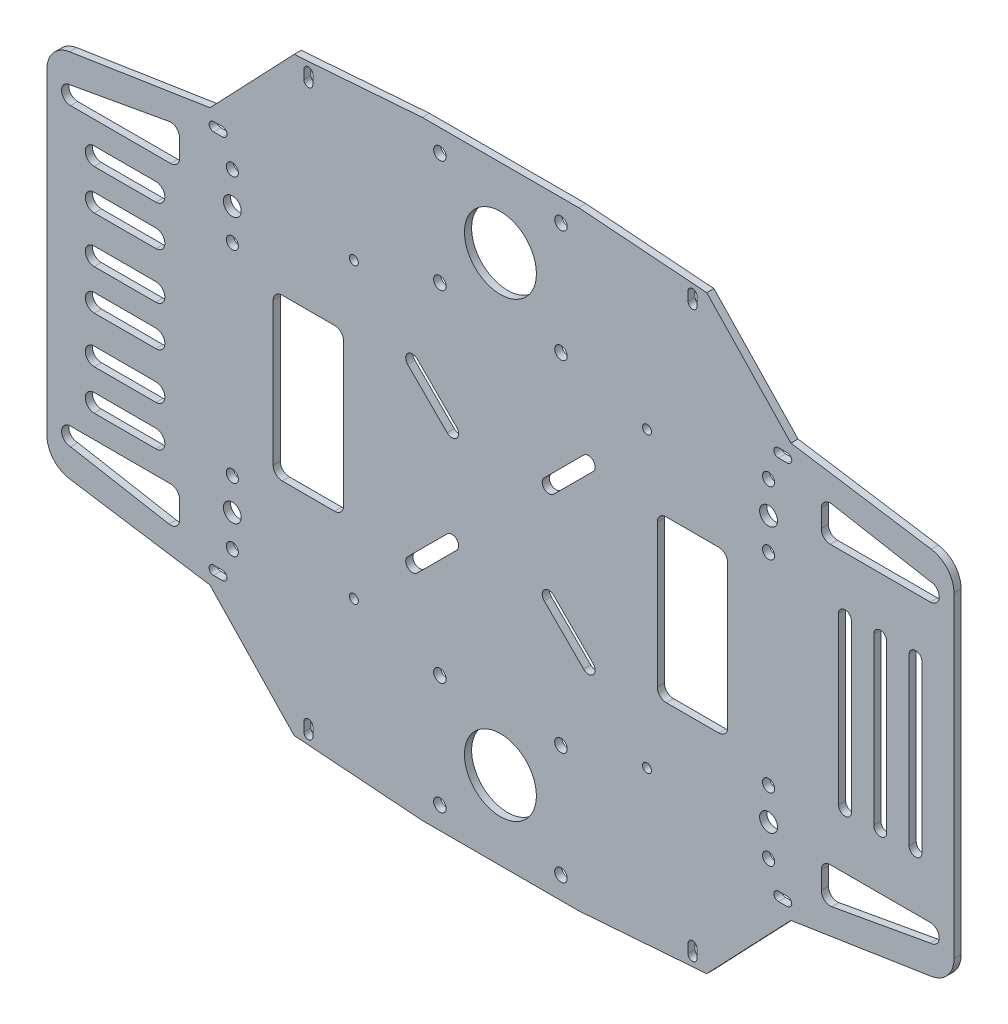
from build123d import *

# Parameters (mm, degrees)
BOSS_EXTRUDE1_DEPTH = 1.6
SKETCH2_R           = 8.05
SKETCH2_R_2         = 1.4
CUT_EXTRUDE1_DEPTH  = 1.6
CUT_EXTRUDE2_DEPTH  = 1.6
CUT_EXTRUDE3_DEPTH  = 1.6
CUT_EXTRUDE4_DEPTH  = 1.6
CUT_EXTRUDE5_DEPTH  = 1.6
SKETCH7_R           = 1
CUT_EXTRUDE6_DEPTH  = 1.6
SKETCH8_R           = 1.35
SKETCH8_R_2         = 2
CUT_EXTRUDE7_DEPTH  = 10


with BuildPart() as part:
    # Sketch1 → Boss-Extrude1 (new body)
    with BuildSketch(Plane.XY):
        with BuildLine():
            Line((0, 68.13), (-17.5, 68.13))
            Line((-17.5, 68.13), (-46.175, 66))
            Line((-46.175, 66), (-65, 46.25))
            Line((-65, 46.25), (-96.417835926, 41.386691151))
            ThreePointArc((-96.417835926, 41.386691151), (-100.055601802, 39.361984306), (-101.5, 35.457308619))
            Line((-101.5, 35.457308619), (-101.5, 0))
            Line((-101.5, 0), (-101.5, -35.457308619))
            ThreePointArc((-101.5, -35.457308619), (-100.055601802, -39.361984306), (-96.417835926, -41.386691151))
            Line((-96.417835926, -41.386691151), (-65, -46.25))
            Line((-65, -46.25), (-46.175, -66))
            Line((-46.175, -66), (-17.5, -68.13))
            Line((-17.5, -68.13), (0, -68.13))
            Line((0, -68.13), (17.5, -68.13))
            Line((17.5, -68.13), (46.175, -66))
            Line((46.175, -66), (65, -46.25))
            Line((65, -46.25), (96.417835926, -41.386691151))
            ThreePointArc((96.417835926, -41.386691151), (100.055601802, -39.361984306), (101.5, -35.457308619))
            Line((101.5, -35.457308619), (101.5, 0))
            Line((101.5, 0), (101.5, 35.457308619))
            ThreePointArc((101.5, 35.457308619), (100.055601802, 39.361984306), (96.417835926, 41.386691151))
            Line((96.417835926, 41.386691151), (65, 46.25))
            Line((65, 46.25), (46.175, 66))
            Line((46.175, 66), (17.5, 68.13))
            Line((17.5, 68.13), (0, 68.13))
        make_face()
    extrude(amount=BOSS_EXTRUDE1_DEPTH)

    # Sketch2 → Cut-Extrude1 (cut)
    with BuildSketch(Plane.XY.offset(1.6)):
        with Locations((0, -50.6)):
            Circle(SKETCH2_R)
        with Locations((0, 50.6)):
            Circle(SKETCH2_R)
        with Locations((-13.55, -38.05)):
            Circle(SKETCH2_R_2)
        with Locations((13.55, -38.05)):
            Circle(SKETCH2_R_2)
        with Locations((13.55, -63.15)):
            Circle(SKETCH2_R_2)
        with Locations((-13.55, -63.15)):
            Circle(SKETCH2_R_2)
        with Locations((-13.55, 38.05)):
            Circle(SKETCH2_R_2)
        with Locations((13.55, 38.05)):
            Circle(SKETCH2_R_2)
        with Locations((-13.55, 63.15)):
            Circle(SKETCH2_R_2)
        with Locations((13.55, 63.15)):
            Circle(SKETCH2_R_2)
    extrude(amount=-CUT_EXTRUDE1_DEPTH, mode=Mode.SUBTRACT)

    # Sketch3 → Cut-Extrude2 (cut)
    with BuildSketch(Plane.XY.offset(1.6)):
        with BuildLine():
            Line((-20.753584028, 18.632263684), (-11.914749263, 9.793428919))
            ThreePointArc((-11.914749263, 9.793428919), (-9.793428919, 9.793428919), (-9.793428919, 11.914749263))
            Line((-9.793428919, 11.914749263), (-18.632263684, 20.753584028))
            ThreePointArc((-18.632263684, 20.753584028), (-20.753584028, 20.753584028), (-20.753584028, 18.632263684))
        make_face()
        with BuildLine():
            Line((18.632263684, 20.753584028), (9.793428919, 11.914749263))
            ThreePointArc((9.793428919, 11.914749263), (9.793428919, 9.793428919), (11.914749263, 9.793428919))
            Line((11.914749263, 9.793428919), (20.753584028, 18.632263684))
            ThreePointArc((20.753584028, 18.632263684), (20.753584028, 20.753584028), (18.632263684, 20.753584028))
        make_face()
        with BuildLine():
            Line((20.753584028, -18.632263684), (11.914749263, -9.793428919))
            ThreePointArc((11.914749263, -9.793428919), (9.793428919, -9.793428919), (9.793428919, -11.914749263))
            Line((9.793428919, -11.914749263), (18.632263684, -20.753584028))
            ThreePointArc((18.632263684, -20.753584028), (20.753584028, -20.753584028), (20.753584028, -18.632263684))
        make_face()
        with BuildLine():
            Line((-18.632263684, -20.753584028), (-9.793428919, -11.914749263))
            ThreePointArc((-9.793428919, -11.914749263), (-9.793428919, -9.793428919), (-11.914749263, -9.793428919))
            Line((-11.914749263, -9.793428919), (-20.753584028, -18.632263684))
            ThreePointArc((-20.753584028, -18.632263684), (-20.753584028, -20.753584028), (-18.632263684, -20.753584028))
        make_face()
        with BuildLine():
            Line((35.1, 16), (35.1, -16))
            ThreePointArc((35.1, -16), (35.685786438, -17.414213562), (37.1, -18))
            Line((37.1, -18), (48.85, -18))
            ThreePointArc((48.85, -18), (50.264213562, -17.414213562), (50.85, -16))
            Line((50.85, -16), (50.85, 16))
            ThreePointArc((50.85, 16), (50.264213562, 17.414213562), (48.85, 18))
            Line((48.85, 18), (37.1, 18))
            ThreePointArc((37.1, 18), (35.685786438, 17.414213562), (35.1, 16))
        make_face()
        with BuildLine():
            Line((-37.1, -18), (-48.85, -18))
            ThreePointArc((-48.85, -18), (-50.264213562, -17.414213562), (-50.85, -16))
            Line((-50.85, -16), (-50.85, 16))
            ThreePointArc((-50.85, 16), (-50.264213562, 17.414213562), (-48.85, 18))
            Line((-48.85, 18), (-37.1, 18))
            ThreePointArc((-37.1, 18), (-35.685786438, 17.414213562), (-35.1, 16))
            Line((-35.1, 16), (-35.1, -16))
            ThreePointArc((-35.1, -16), (-35.685786438, -17.414213562), (-37.1, -18))
        make_face()
    extrude(amount=-CUT_EXTRUDE2_DEPTH, mode=Mode.SUBTRACT)

    # Sketch4 → Cut-Extrude3 (cut)
    with BuildSketch(Plane.XY.offset(1.6)):
        with BuildLine():
            Line((84, 31.05), (73.8, 31.05))
            ThreePointArc((73.8, 31.05), (72.385786438, 31.635786438), (71.8, 33.05))
            Line((71.8, 33.05), (71.8, 37.05))
            ThreePointArc((71.8, 37.05), (72.517158721, 38.584378784), (74.154318254, 39.018364442))
            Line((74.154318254, 39.018364442), (96.2, 35.05))
            ThreePointArc((96.2, 35.05), (98.2, 33.05), (96.2, 31.05))
            Line((96.2, 31.05), (84, 31.05))
        make_face()
        with BuildLine():
            Line((-84, 31.05), (-96.2, 31.05))
            ThreePointArc((-96.2, 31.05), (-98.2, 33.05), (-96.2, 35.05))
            Line((-96.2, 35.05), (-74.154318254, 39.018364442))
            ThreePointArc((-74.154318254, 39.018364442), (-72.517158721, 38.584378784), (-71.8, 37.05))
            Line((-71.8, 37.05), (-71.8, 33.05))
            ThreePointArc((-71.8, 33.05), (-72.385786438, 31.635786438), (-73.8, 31.05))
            Line((-73.8, 31.05), (-84, 31.05))
        make_face()
        with BuildLine():
            Line((84, -31.05), (96.2, -31.05))
            ThreePointArc((96.2, -31.05), (98.2, -33.05), (96.2, -35.05))
            Line((96.2, -35.05), (74.154318254, -39.018364442))
            ThreePointArc((74.154318254, -39.018364442), (72.517158721, -38.584378784), (71.8, -37.05))
            Line((71.8, -37.05), (71.8, -33.05))
            ThreePointArc((71.8, -33.05), (72.385786438, -31.635786438), (73.8, -31.05))
            Line((73.8, -31.05), (84, -31.05))
        make_face()
        with BuildLine():
            Line((-84, -31.05), (-73.8, -31.05))
            ThreePointArc((-73.8, -31.05), (-72.385786438, -31.635786438), (-71.8, -33.05))
            Line((-71.8, -33.05), (-71.8, -37.05))
            ThreePointArc((-71.8, -37.05), (-72.517158721, -38.584378784), (-74.154318254, -39.018364442))
            Line((-74.154318254, -39.018364442), (-96.2, -35.05))
            ThreePointArc((-96.2, -35.05), (-98.2, -33.05), (-96.2, -31.05))
            Line((-96.2, -31.05), (-84, -31.05))
        make_face()
    extrude(amount=-CUT_EXTRUDE3_DEPTH, mode=Mode.SUBTRACT)

    # Sketch5 → Cut-Extrude4 (cut)
    with BuildSketch(Plane.XY.offset(1.6)):
        with BuildLine():
            Line((-90.9, 16.9), (-77.1, 16.9))
            ThreePointArc((-77.1, 16.9), (-75.1, 14.9), (-77.1, 12.9))
            Line((-77.1, 12.9), (-90.9, 12.9))
            ThreePointArc((-90.9, 12.9), (-92.9, 14.9), (-90.9, 16.9))
        make_face()
        with BuildLine():
            Line((-90.9, 6.5), (-77.1, 6.5))
            ThreePointArc((-77.1, 6.5), (-75.1, 4.5), (-77.1, 2.5))
            Line((-77.1, 2.5), (-90.9, 2.5))
            ThreePointArc((-90.9, 2.5), (-92.9, 4.5), (-90.9, 6.5))
        make_face()
        with BuildLine():
            Line((-90.9, 25.9), (-77.1, 25.9))
            ThreePointArc((-77.1, 25.9), (-75.1, 23.9), (-77.1, 21.9))
            Line((-77.1, 21.9), (-90.9, 21.9))
            ThreePointArc((-90.9, 21.9), (-92.9, 23.9), (-90.9, 25.9))
        make_face()
        with BuildLine():
            Line((-90.9, -2.5), (-77.1, -2.5))
            ThreePointArc((-77.1, -2.5), (-75.1, -4.5), (-77.1, -6.5))
            Line((-77.1, -6.5), (-90.9, -6.5))
            ThreePointArc((-90.9, -6.5), (-92.9, -4.5), (-90.9, -2.5))
        make_face()
        with BuildLine():
            Line((-90.9, -12.9), (-77.1, -12.9))
            ThreePointArc((-77.1, -12.9), (-75.1, -14.9), (-77.1, -16.9))
            Line((-77.1, -16.9), (-90.9, -16.9))
            ThreePointArc((-90.9, -16.9), (-92.9, -14.9), (-90.9, -12.9))
        make_face()
        with BuildLine():
            Line((-90.9, -21.9), (-77.1, -21.9))
            ThreePointArc((-77.1, -21.9), (-75.1, -23.9), (-77.1, -25.9))
            Line((-77.1, -25.9), (-90.9, -25.9))
            ThreePointArc((-90.9, -25.9), (-92.9, -23.9), (-90.9, -21.9))
        make_face()
    extrude(amount=-CUT_EXTRUDE4_DEPTH, mode=Mode.SUBTRACT)

    # Sketch6 → Cut-Extrude5 (cut)
    with BuildSketch(Plane.XY.offset(1.6)):
        with BuildLine():
            Line((86.45, -18.55), (86.45, 18.55))
            ThreePointArc((86.45, 18.55), (85, 20), (83.55, 18.55))
            Line((83.55, 18.55), (83.55, -18.55))
            ThreePointArc((83.55, -18.55), (85, -20), (86.45, -18.55))
        make_face()
        with BuildLine():
            Line((78.55, -18.55), (78.55, 18.55))
            ThreePointArc((78.55, 18.55), (77.1, 20), (75.65, 18.55))
            Line((75.65, 18.55), (75.65, -18.55))
            ThreePointArc((75.65, -18.55), (77.1, -20), (78.55, -18.55))
        make_face()
        with BuildLine():
            Line((94.35, -18.55), (94.35, 18.55))
            ThreePointArc((94.35, 18.55), (92.9, 20), (91.45, 18.55))
            Line((91.45, 18.55), (91.45, -18.55))
            ThreePointArc((91.45, -18.55), (92.9, -20), (94.35, -18.55))
        make_face()
    extrude(amount=-CUT_EXTRUDE5_DEPTH, mode=Mode.SUBTRACT)

    # Sketch7 → Cut-Extrude6 (cut)
    with BuildSketch(Plane.XY.offset(1.6)):
        with Locations((-32.803950566, 32.803950566)):
            Circle(SKETCH7_R)
        with Locations((32.803950566, 32.803950566)):
            Circle(SKETCH7_R)
        with Locations((32.803950566, -32.803950566)):
            Circle(SKETCH7_R)
        with Locations((-32.803950566, -32.803950566)):
            Circle(SKETCH7_R)
        with BuildLine():
            Line((-64.195127905, 43.982063617), (-62.195127905, 43.982063617))
            ThreePointArc((-62.195127905, 43.982063617), (-61.195169294, 42.97296549), (-62.213323405, 41.982229168))
            Line((-62.213323405, 41.982229168), (-64.176932405, 41.982229168))
            ThreePointArc((-64.176932405, 41.982229168), (-65.195086516, 42.97296549), (-64.195127905, 43.982063617))
        make_face()
        with BuildLine():
            Line((-43.981853461, 64.195196044), (-43.981853461, 62.195196044))
            ThreePointArc((-43.981853461, 62.195196044), (-42.981853461, 61.195196044), (-41.981853461, 62.195196044))
            Line((-41.981853461, 62.195196044), (-41.981853461, 64.195196044))
            ThreePointArc((-41.981853461, 64.195196044), (-42.981853461, 65.195196044), (-43.981853461, 64.195196044))
        make_face()
        with BuildLine():
            Line((64.195196044, 41.981853461), (62.195196044, 41.981853461))
            ThreePointArc((62.195196044, 41.981853461), (61.195196044, 42.981853461), (62.195196044, 43.981853461))
            Line((62.195196044, 43.981853461), (64.195196044, 43.981853461))
            ThreePointArc((64.195196044, 43.981853461), (65.195196044, 42.981853461), (64.195196044, 41.981853461))
        make_face()
        with BuildLine():
            Line((41.982229168, 64.176932405), (41.982229168, 62.213323405))
            ThreePointArc((41.982229168, 62.213323405), (42.97296549, 61.195169294), (43.982063617, 62.195127905))
            Line((43.982063617, 62.195127905), (43.982063617, 64.195127905))
            ThreePointArc((43.982063617, 64.195127905), (42.97296549, 65.195086516), (41.982229168, 64.176932405))
        make_face()
        with BuildLine():
            Line((41.981853461, -64.195196044), (41.981853461, -62.195196044))
            ThreePointArc((41.981853461, -62.195196044), (42.981853461, -61.195196044), (43.981853461, -62.195196044))
            Line((43.981853461, -62.195196044), (43.981853461, -64.195196044))
            ThreePointArc((43.981853461, -64.195196044), (42.981853461, -65.195196044), (41.981853461, -64.195196044))
        make_face()
        with BuildLine():
            Line((64.176932405, -41.982229168), (62.213323405, -41.982229168))
            ThreePointArc((62.213323405, -41.982229168), (61.195169294, -42.97296549), (62.195127905, -43.982063617))
            Line((62.195127905, -43.982063617), (64.195127905, -43.982063617))
            ThreePointArc((64.195127905, -43.982063617), (65.195086516, -42.97296549), (64.176932405, -41.982229168))
        make_face()
        with BuildLine():
            Line((-64.195196044, -41.981853461), (-62.195196044, -41.981853461))
            ThreePointArc((-62.195196044, -41.981853461), (-61.195196044, -42.981853461), (-62.195196044, -43.981853461))
            Line((-62.195196044, -43.981853461), (-64.195196044, -43.981853461))
            ThreePointArc((-64.195196044, -43.981853461), (-65.195196044, -42.981853461), (-64.195196044, -41.981853461))
        make_face()
        with BuildLine():
            Line((-41.982229168, -64.176932405), (-41.982229168, -62.213323405))
            ThreePointArc((-41.982229168, -62.213323405), (-42.97296549, -61.195169294), (-43.982063617, -62.195127905))
            Line((-43.982063617, -62.195127905), (-43.982063617, -64.195127905))
            ThreePointArc((-43.982063617, -64.195127905), (-42.97296549, -65.195086516), (-41.982229168, -64.176932405))
        make_face()
    extrude(amount=-CUT_EXTRUDE6_DEPTH, mode=Mode.SUBTRACT)

    # Sketch8 → Cut-Extrude7 (cut)
    with BuildSketch(Plane.XY.offset(1.6)):
        with Locations((60, 22.58)):
            Circle(SKETCH8_R)
        with Locations((60, 29.68)):
            Circle(SKETCH8_R_2)
        with Locations((60, 36.78)):
            Circle(SKETCH8_R)
        with Locations((60, -22.58)):
            Circle(SKETCH8_R)
        with Locations((60, -29.68)):
            Circle(SKETCH8_R_2)
        with Locations((60, -36.78)):
            Circle(SKETCH8_R)
        with Locations((-60, -36.78)):
            Circle(SKETCH8_R)
        with Locations((-60, -22.58)):
            Circle(SKETCH8_R)
        with Locations((-60, -29.68)):
            Circle(SKETCH8_R_2)
        with Locations((-60, 22.58)):
            Circle(SKETCH8_R)
        with Locations((-60, 29.68)):
            Circle(SKETCH8_R_2)
        with Locations((-60, 36.78)):
            Circle(SKETCH8_R)
    extrude(amount=-CUT_EXTRUDE7_DEPTH, mode=Mode.SUBTRACT)


solid = part.part
